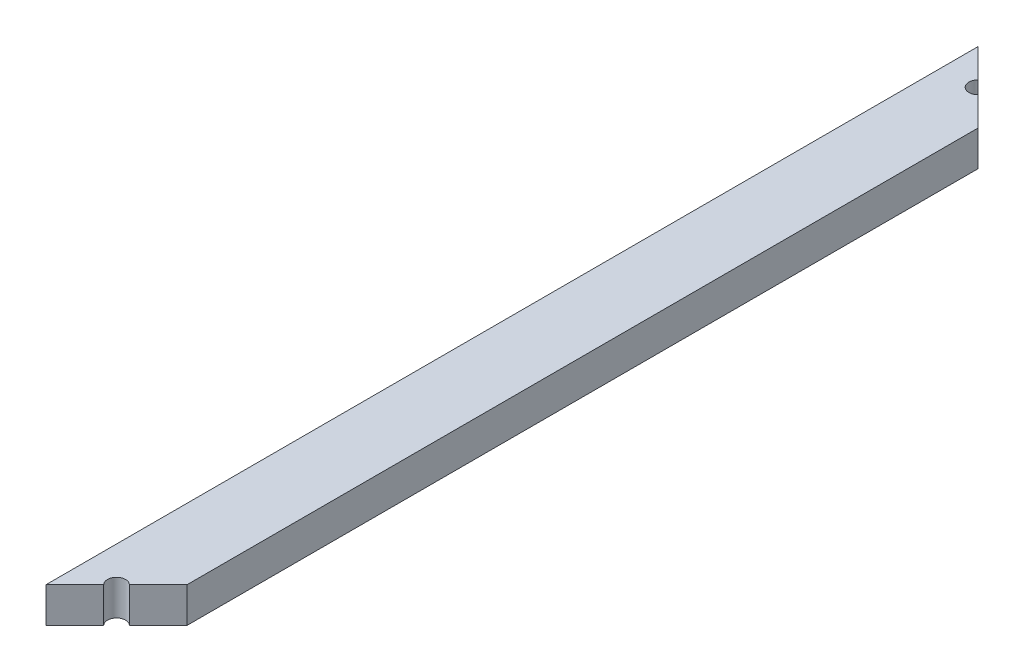
from build123d import *

# Parameters (mm, degrees)
SKETCH1_W           = 14
SKETCH1_H           = 7
BOSS_EXTRUDE1_DEPTH = 185
CUT_EXTRUDE1_DEPTH  = 186.660981361
CUT_EXTRUDE2_DEPTH  = 186.660981361


with BuildPart() as part:
    # Sketch1 → Boss-Extrude1 (new body)
    with BuildSketch(Plane.XY):
        with Locations((7, 3.5)):
            Rectangle(SKETCH1_W, SKETCH1_H)
    extrude(amount=BOSS_EXTRUDE1_DEPTH)

    # Sketch2 → Cut-Extrude1 (cut, through all)
    with BuildSketch(Plane(origin=(0, 7, 0), x_dir=(1, 0, 0), z_dir=(0, 1, 0))):
        Polygon((0, 0), (14, -14), (14, 0), align=None)
        Polygon((14, -185), (0, -185), (14, -171), align=None)
    extrude(amount=-CUT_EXTRUDE1_DEPTH, mode=Mode.SUBTRACT)

    # Sketch3 → Cut-Extrude2 (cut, through all)
    with BuildSketch(Plane(origin=(0, 7, 0), x_dir=(1, 0, 0), z_dir=(0, 1, 0))):
        with BuildLine():
            Line((8.272792206, -176.727207794), (5.727207794, -179.272792206))
            ThreePointArc((5.727207794, -179.272792206), (5.727207794, -176.727207794), (8.272792206, -176.727207794))
        make_face()
        with BuildLine():
            Line((5.727207794, -5.727207794), (8.272792206, -8.272792206))
            ThreePointArc((8.272792206, -8.272792206), (5.727207794, -8.272792206), (5.727207794, -5.727207794))
        make_face()
    extrude(amount=-CUT_EXTRUDE2_DEPTH, mode=Mode.SUBTRACT)


solid = part.part
